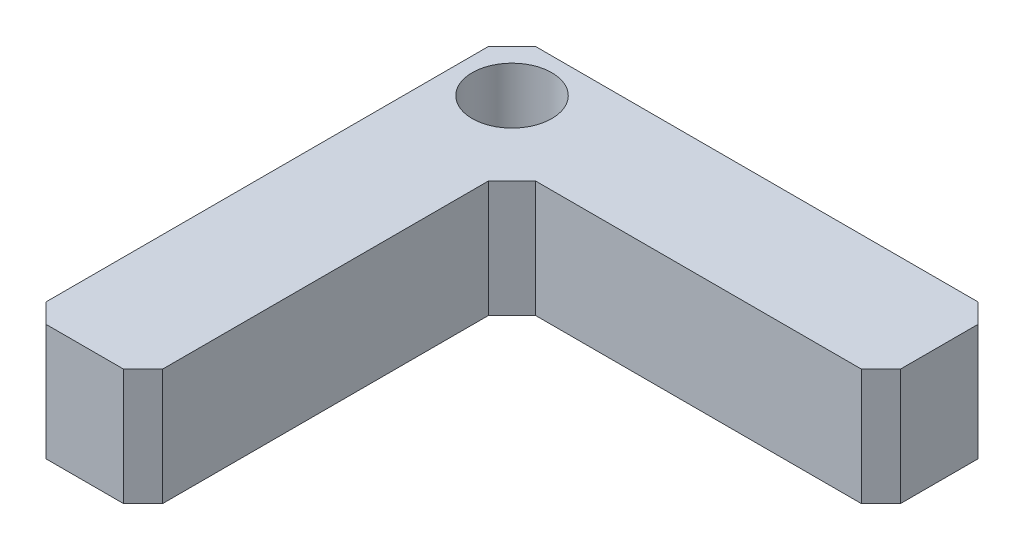
from build123d import *

# Parameters (mm, degrees)
SKETCH1_R           = 5.125
BOSS_EXTRUDE1_DEPTH = 15


with BuildPart() as part:
    # Sketch1 → Boss-Extrude1 (new body)
    with BuildSketch(Plane(origin=(0, 0, 0), x_dir=(1, 0, 0), z_dir=(0, 1, 0))):
        Polygon((-3, -60), (-0.5, -62.5), (9.5, -62.5), (12, -60), (12, -17.998132752), (14.998132752, -15), (57, -15), (59.5, -12.5), (59.5, -2.5), (57, 0), (0, 0), (-3, -3), align=None)
        with Locations(Location((4, -7, 0), (0, 0, 270))):
            Circle(SKETCH1_R, mode=Mode.SUBTRACT)
    extrude(amount=BOSS_EXTRUDE1_DEPTH)


solid = part.part
